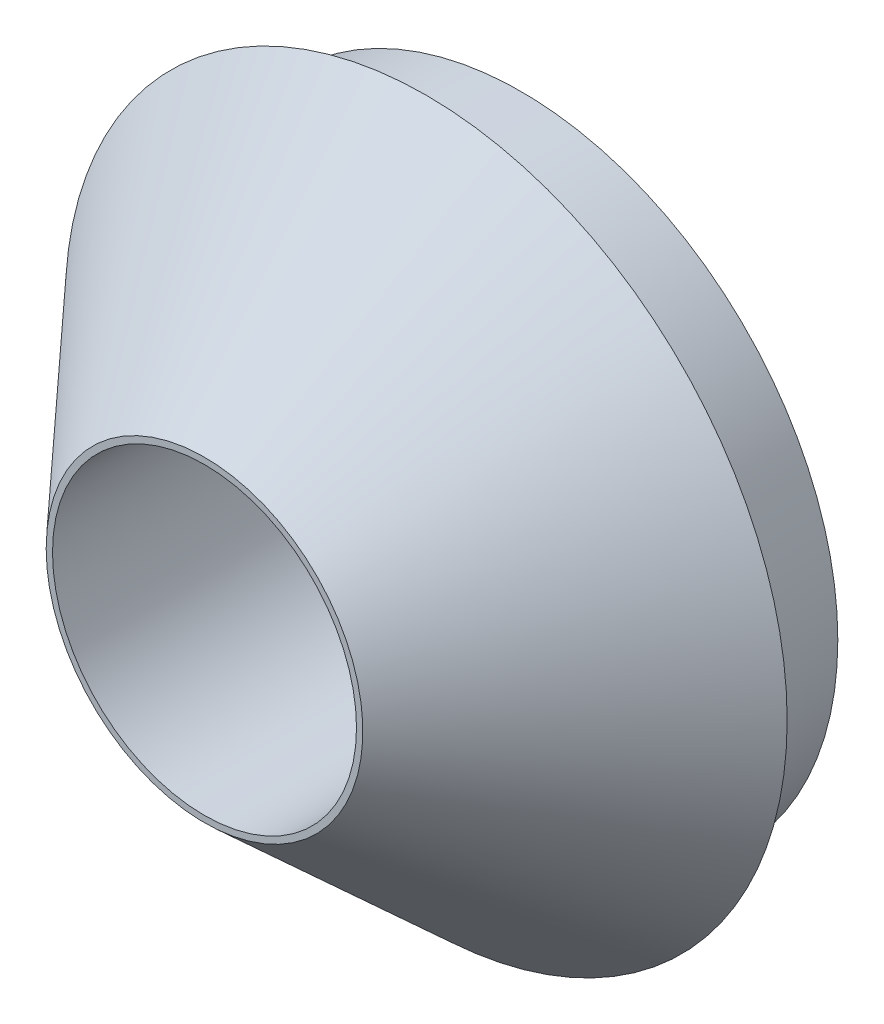
from build123d import *

# Parameters (mm, degrees)
SKETCH2_R          = 6.096
CUT_EXTRUDE1_DEPTH = 12.7


with BuildPart() as part:
    # Sketch1 → Revolve1 (revolve)
    with BuildSketch(Plane(origin=(0, 0, 0), x_dir=(1, 0, 0), z_dir=(0, 1, 0)), mode=Mode.PRIVATE) as revolve1_sk:
        Polygon((0, 0), (6.35, 0), (14.478, 8.89), (12.7, 8.89), (12.7, 12.7), (0, 12.7), align=None)
    revolve(revolve1_sk.sketch.rotate(Axis((0, 0, -12.7), (0, 0, 1)), 180), axis=Axis((0, 0, -12.7), (0, 0, 1)))

    # Sketch2 → Cut-Extrude1 (cut)
    with BuildSketch(Plane(origin=(0, 0, -12.7), x_dir=(-1, 0, 0), z_dir=(0, 0, -1))):
        Circle(SKETCH2_R)
    extrude(amount=-CUT_EXTRUDE1_DEPTH, mode=Mode.SUBTRACT)


solid = part.part
